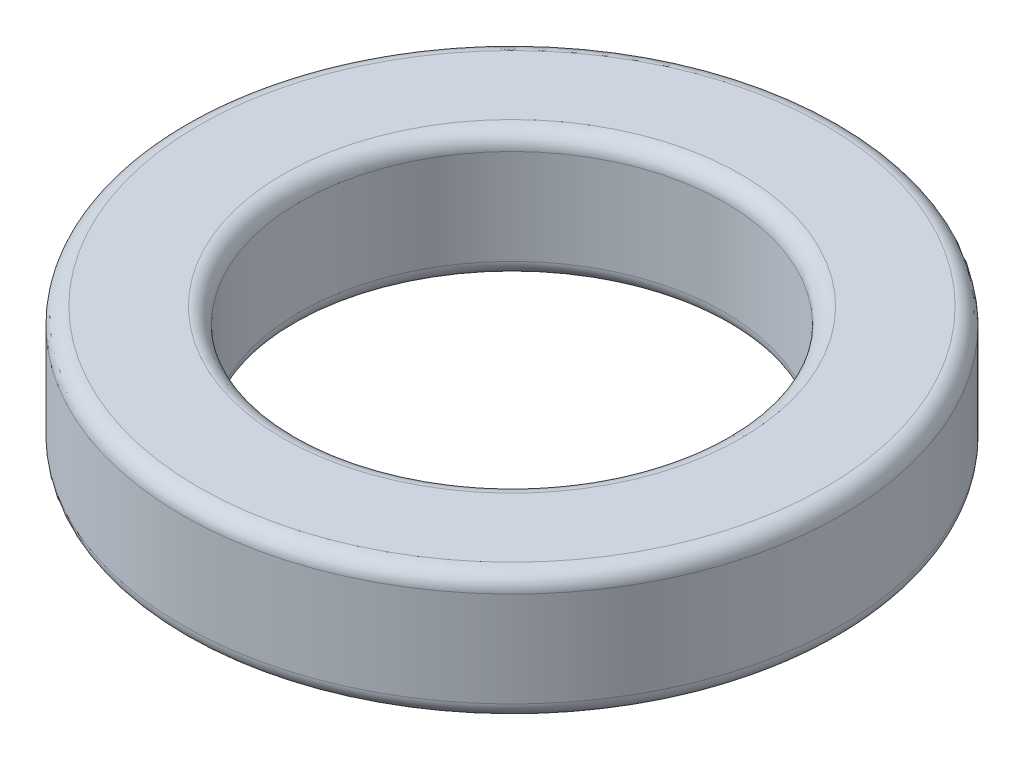
from build123d import *

# Parameters (mm, degrees)
SKETCH1_R           = 31
SKETCH1_R_2         = 20
BOSS_EXTRUDE1_DEPTH = 6
FILLET1_R           = 1.524


with BuildPart() as part:
    # Sketch1 → Boss-Extrude1 (new, symmetric)
    with BuildSketch(Plane(origin=(0, 0, 0), x_dir=(1, 0, 0), z_dir=(0, 1, 0))):
        with Locations(Location((0, 0, 0), (0, 0, 270))):
            Circle(SKETCH1_R)
        with Locations(Location((0, 0, 0), (0, 0, 270))):
            Circle(SKETCH1_R_2, mode=Mode.SUBTRACT)
    extrude(amount=BOSS_EXTRUDE1_DEPTH, both=True)

    # Fillet1
    fillet1_edges = [part.edges().sort_by_distance(p)[0] for p in [
        (0, -6, -31),
        (0, 6, -31),
        (0, -6, -20),
        (0, 6, -20),
    ]]
    fillet(fillet1_edges, radius=FILLET1_R)


solid = part.part
